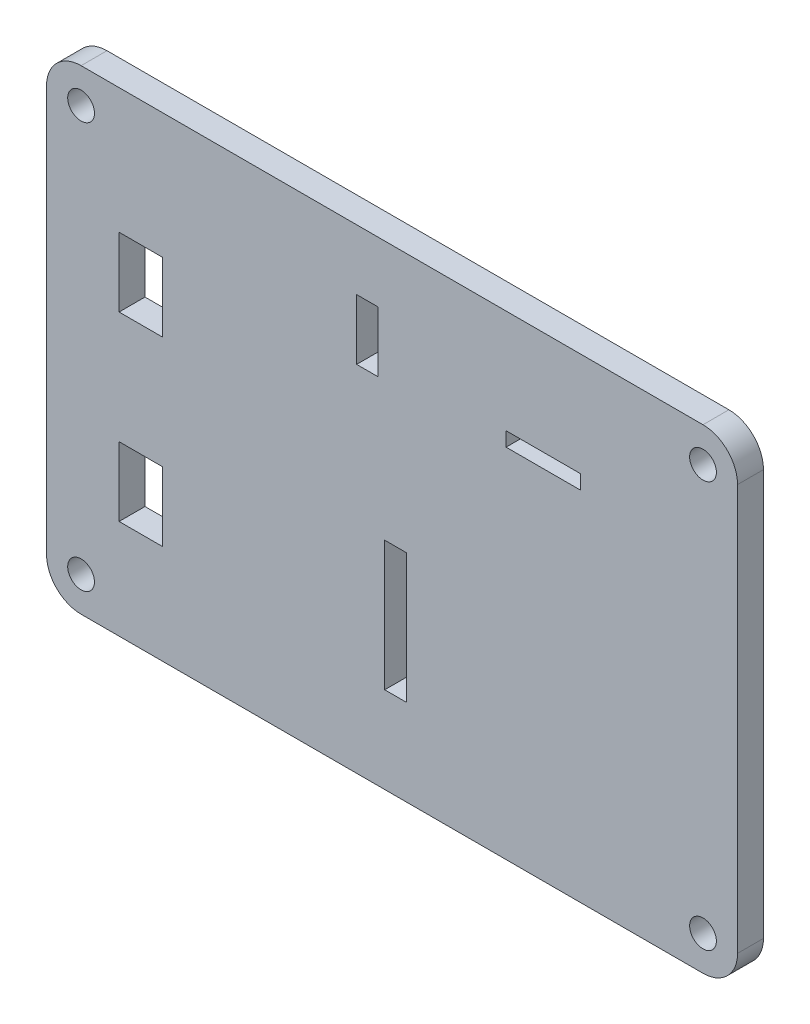
from build123d import *

# Parameters (mm, degrees)
ESQUISSE1_R        = 1.55
ESQUISSE1_W        = 5
ESQUISSE1_H        = 8
ESQUISSE1_W_2      = 2.5
ESQUISSE1_H_2      = 15
ESQUISSE1_H_3      = 7
ESQUISSE1_W_3      = 8.6
ESQUISSE1_H_4      = 1.65
BOSS_EXTRU_1_DEPTH = 3


with BuildPart() as part:
    # Esquisse1 → Boss.-Extru.1 (new body)
    with BuildSketch(Plane.XY):
        with BuildLine():
            Line((36, 27.5), (-36, 27.5))
            ThreePointArc((-36, 27.5), (-38.828427125, 26.328427125), (-40, 23.5))
            Line((-40, 23.5), (-40, -23.5))
            ThreePointArc((-40, -23.5), (-38.828427125, -26.328427125), (-36, -27.5))
            Line((-36, -27.5), (36, -27.5))
            ThreePointArc((36, -27.5), (38.828427125, -26.328427125), (40, -23.5))
            Line((40, -23.5), (40, 23.5))
            ThreePointArc((40, 23.5), (38.828427125, 26.328427125), (36, 27.5))
        make_face()
        with Locations((-36, 23.5)):
            Circle(ESQUISSE1_R, mode=Mode.SUBTRACT)
        with Locations((-36, -23.5)):
            Circle(ESQUISSE1_R, mode=Mode.SUBTRACT)
        with Locations((36, -23.5)):
            Circle(ESQUISSE1_R, mode=Mode.SUBTRACT)
        with Locations((36, 23.5)):
            Circle(ESQUISSE1_R, mode=Mode.SUBTRACT)
        with Locations((-29.1, -12)):
            Rectangle(ESQUISSE1_W, ESQUISSE1_H, mode=Mode.SUBTRACT)
        with Locations((-29.1, 9)):
            Rectangle(ESQUISSE1_W, ESQUISSE1_H, mode=Mode.SUBTRACT)
        with Locations((0.4, -10)):
            Rectangle(ESQUISSE1_W_2, ESQUISSE1_H_2, mode=Mode.SUBTRACT)
        with Locations((-2.85, 17)):
            Rectangle(ESQUISSE1_W_2, ESQUISSE1_H_3, mode=Mode.SUBTRACT)
        with Locations((17.5, 14.675)):
            Rectangle(ESQUISSE1_W_3, ESQUISSE1_H_4, mode=Mode.SUBTRACT)
    extrude(amount=BOSS_EXTRU_1_DEPTH)


solid = part.part
